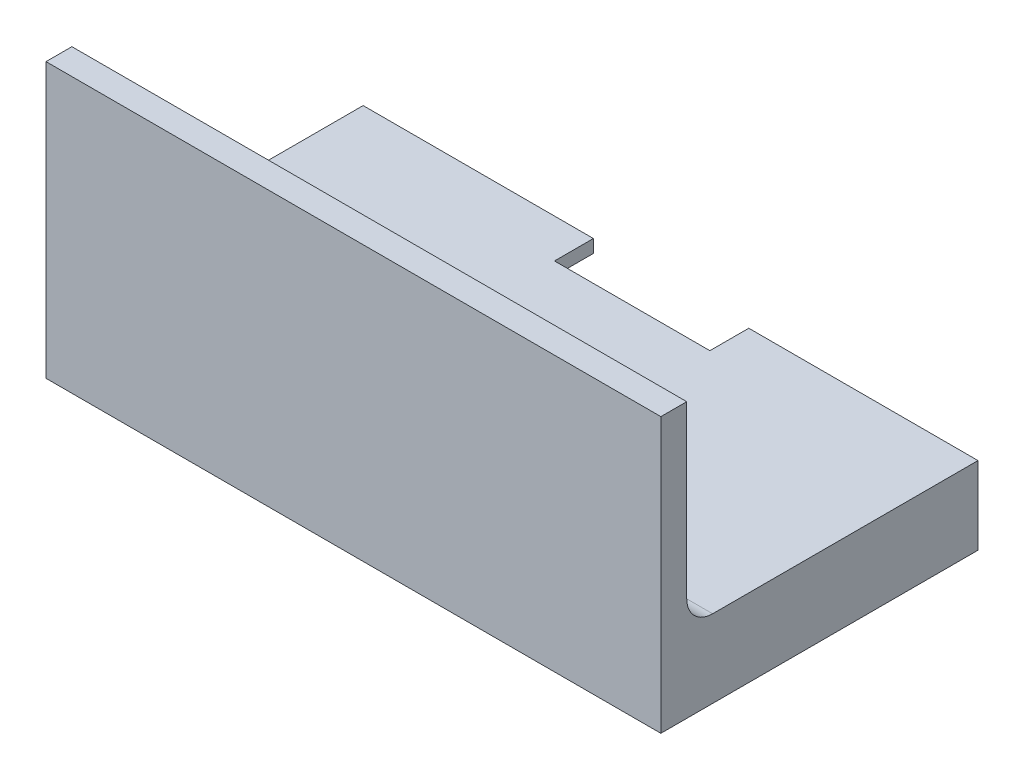
from build123d import *

# Parameters (mm, degrees)
SKETCH3_W           = 47.5
SKETCH3_H           = 22.5
BOSS_EXTRUDE1_DEPTH = 6
SKETCH74_W          = 12.004185621
SKETCH74_H          = 3.004883548
CUT_EXTRUDE6_DEPTH  = 10
SKETCH79_W          = 47.5
SKETCH79_H          = 2
BOSS_EXTRUDE2_DEPTH = 21.190075336
FILLET6_R           = 2
SKETCH82_W          = 45.5
SKETCH82_H          = 4
CUT_EXTRUDE7_DEPTH  = 20.5
SKETCH84_W          = 43.5
SKETCH84_H          = 1
CUT_EXTRUDE8_DEPTH  = 20


with BuildPart() as part:
    # Sketch3 → Boss-Extrude1 (new body)
    with BuildSketch(Plane(origin=(0, 0, 0), x_dir=(1, 0, 0), z_dir=(0, 1, 0))):
        with Locations((-56.111912524, -4.514800621)):
            Rectangle(SKETCH3_W, SKETCH3_H)
    extrude(amount=BOSS_EXTRUDE1_DEPTH)

    # Sketch74 → Cut-Extrude6 (cut)
    with BuildSketch(Plane(origin=(0, 6, 0), x_dir=(1, 0, 0), z_dir=(0, 1, 0))):
        with Locations((-56.07183951, 5.232757605)):
            Rectangle(SKETCH74_W, SKETCH74_H)
    extrude(amount=-CUT_EXTRUDE6_DEPTH, mode=Mode.SUBTRACT)

    # Sketch79 → Boss-Extrude2 (add)
    with BuildSketch(Plane(origin=(0, 0, 0), x_dir=(1, 0, 0), z_dir=(0, 1, 0))):
        with Locations((-56.111912524, -16.764800621)):
            Rectangle(SKETCH79_W, SKETCH79_H)
    extrude(amount=BOSS_EXTRUDE2_DEPTH)

    # Fillet6
    fillet6_edges = [part.edges().sort_by_distance(p)[0] for p in [
        (-56.111912524, 6, 15.764800621),
    ]]
    fillet(fillet6_edges, radius=FILLET6_R)

    # Sketch82 → Cut-Extrude7 (cut)
    with BuildSketch(Plane(origin=(0, 0, -6.735199379), x_dir=(-1, 0, 0), z_dir=(0, 0, -1))):
        with Locations((56.111912524, 3)):
            Rectangle(SKETCH82_W, SKETCH82_H)
    extrude(amount=-CUT_EXTRUDE7_DEPTH, mode=Mode.SUBTRACT)

    # Sketch84 → Cut-Extrude8 (cut)
    with BuildSketch(Plane(origin=(0, 0, -6.735199379), x_dir=(-1, 0, 0), z_dir=(0, 0, -1))):
        with Locations((56.111912524, 0.5)):
            Rectangle(SKETCH84_W, SKETCH84_H)
    extrude(amount=-CUT_EXTRUDE8_DEPTH, mode=Mode.SUBTRACT)


solid = part.part
